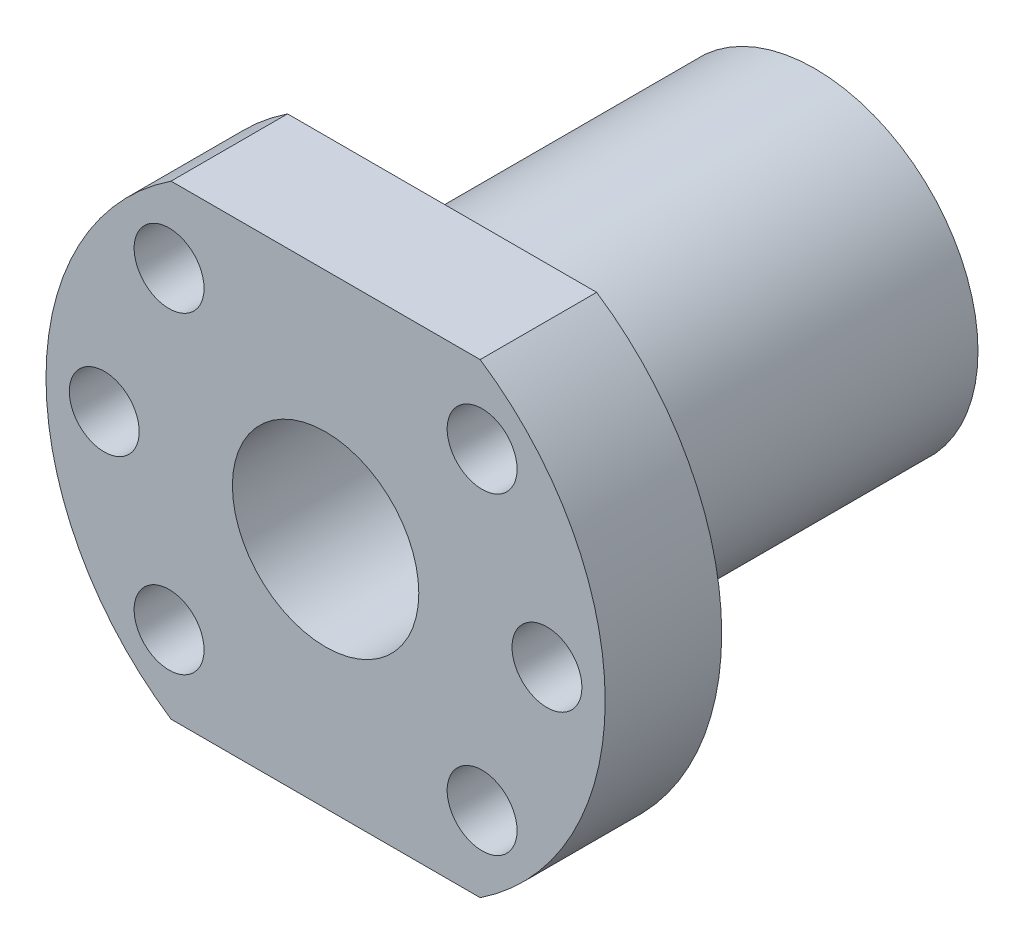
from build123d import *

# Parameters (mm, degrees)
SKETCH1_R           = 3
SKETCH1_R_2         = 14
SKETCH1_R_3         = 8
BOSS_EXTRUDE1_DEPTH = 10
BOSS_EXTRUDE2_START = -32
SKETCH1_3_R         = 14
SKETCH1_3_R_2       = 8
BOSS_EXTRUDE2_DEPTH = 32


with BuildPart() as part:
    # Sketch1 → Boss-Extrude1 (new body)
    # profile 1 of 2: a face of its own
    with BuildSketch(Plane.XY):
        with BuildLine():
            Line((-13.266499161, 20), (13.266499161, 20))
            ThreePointArc((13.266499161, 20), (24, 0), (13.266499161, -20))
            Line((13.266499161, -20), (-13.266499161, -20))
            ThreePointArc((-13.266499161, -20), (-24, 0), (-13.266499161, 20))
        make_face()
        with Locations((13.435028843, 13.435028843)):
            Circle(SKETCH1_R, mode=Mode.SUBTRACT)
        with Locations((-13.435028843, 13.435028843)):
            Circle(SKETCH1_R, mode=Mode.SUBTRACT)
        with Locations((-19, 0)):
            Circle(SKETCH1_R, mode=Mode.SUBTRACT)
        with Locations((-13.435028843, -13.435028843)):
            Circle(SKETCH1_R, mode=Mode.SUBTRACT)
        with Locations((13.435028843, -13.435028843)):
            Circle(SKETCH1_R, mode=Mode.SUBTRACT)
        with Locations((19, 0)):
            Circle(SKETCH1_R, mode=Mode.SUBTRACT)
        Circle(SKETCH1_R_2, mode=Mode.SUBTRACT)
    # profile 2 of 2: a face of its own
    with BuildSketch(Plane.XY):
        Circle(SKETCH1_R_2)
        Circle(SKETCH1_R_3, mode=Mode.SUBTRACT)
    extrude(amount=BOSS_EXTRUDE1_DEPTH)

    # Sketch1<3> → Boss-Extrude2 (add)
    with BuildSketch(Plane.XY.offset(BOSS_EXTRUDE2_START)):
        Circle(SKETCH1_3_R)
        Circle(SKETCH1_3_R_2, mode=Mode.SUBTRACT)
    extrude(amount=BOSS_EXTRUDE2_DEPTH)


solid = part.part
